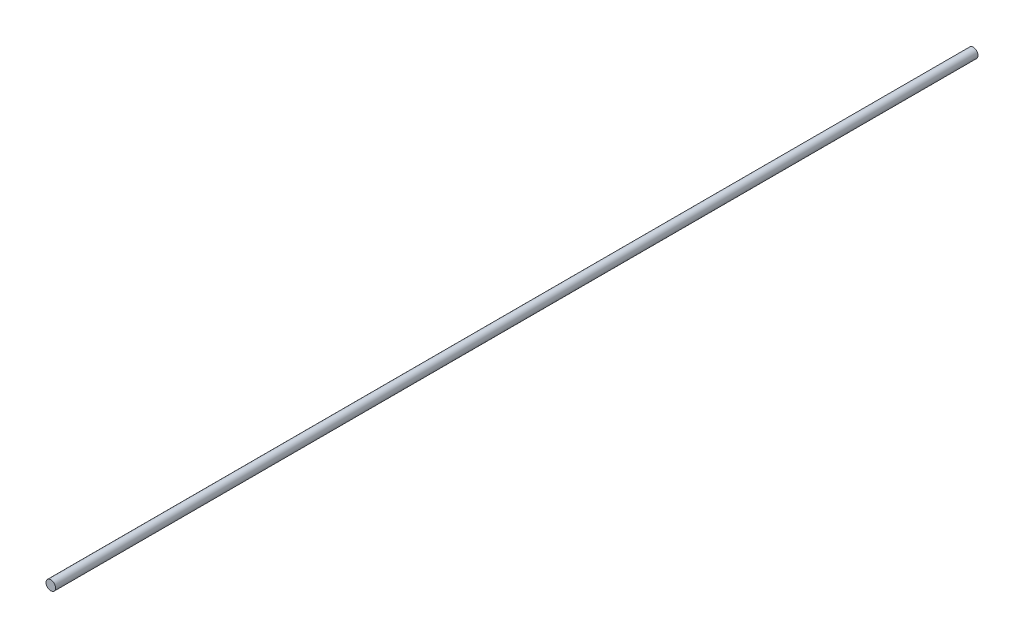
from build123d import *

# Parameters (mm, degrees)
SKIZZE1_R                       = 4
AUFSATZ_LINEAR_AUSTRAGEN1_DEPTH = 770


with BuildPart() as part:
    # Skizze1 → Aufsatz-Linear austragen1 (new body)
    with BuildSketch(Plane.XY):
        Circle(SKIZZE1_R)
    extrude(amount=AUFSATZ_LINEAR_AUSTRAGEN1_DEPTH)


solid = part.part
